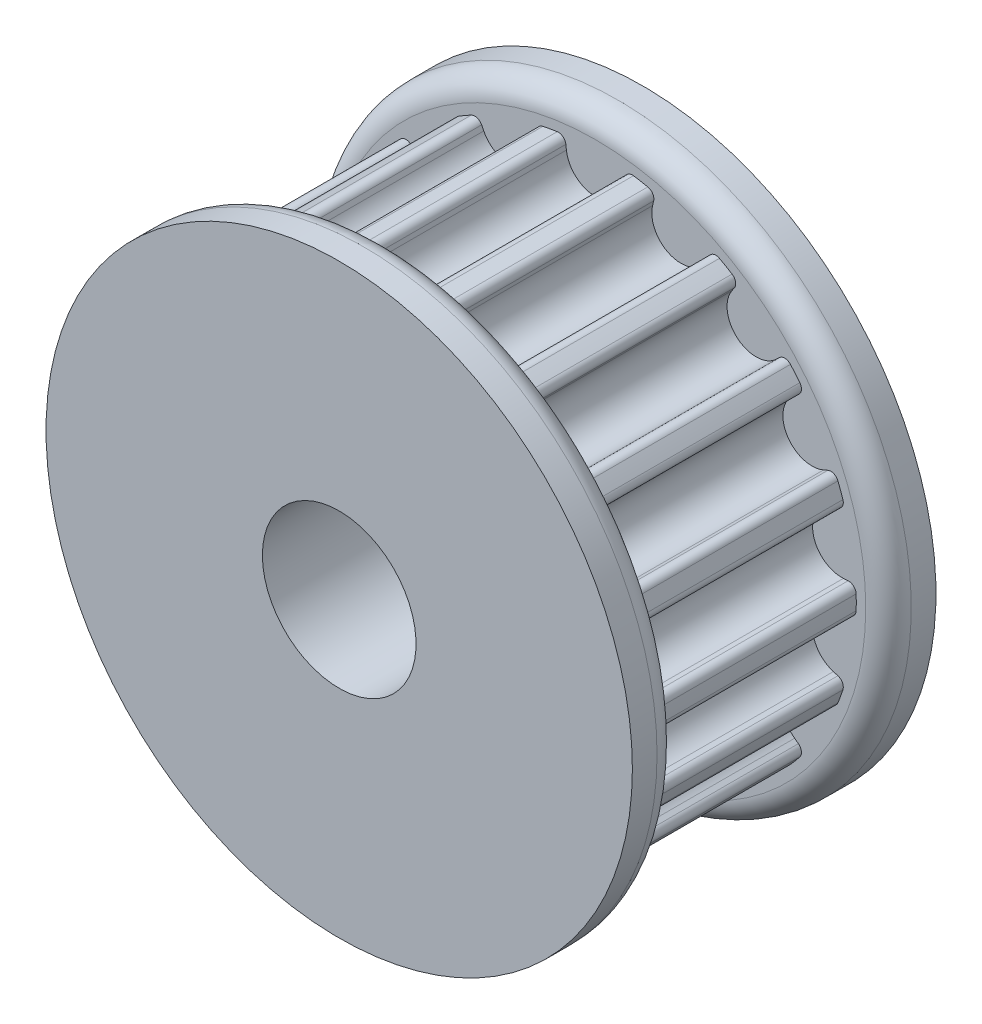
from build123d import *

# Parameters (mm, degrees)
SKETCH_3_R                       = 13.752444878
EXTRUDE_2_DEPTH                  = 5.5
CUT_EXTRUDE_2_DEPTH              = 21.211617458
FILLET_1_R                       = 0.4
PATTERN_CIRCULAR_1_COUNT         = 18
FILLET_1_OF_PATTERN_CIRCULAR_1_R = 0.4
SKETCH_12_R                      = 15.452444878
EXTRUDE_4_DEPTH                  = 2.5
EXTRUDE_START                    = 2.5
SKETCH_13_R                      = 15.452444878
EXTRUDE_5_DEPTH                  = 2.5
FILLET_2_R                       = 1.2
SKETCH_5_R                       = 9
EXTRUDE_3_DEPTH                  = 3
SKETCH_4_R                       = 4.05
CUT_EXTRUDE_3_DEPTH              = 29.957833231
SKETCH_8_W                       = 1.2
SKETCH_8_H                       = 15.452444878


with BuildPart() as part:
    # 스케치3 → 보스-돌출2 (new, symmetric)
    with BuildSketch(Plane.XY):
        Circle(SKETCH_3_R)
    extrude(amount=EXTRUDE_2_DEPTH, both=True)

    # 스케치3<3> → 컷-돌출2 (cut, symmetric)
    with BuildSketch(Plane.XY):
        with BuildLine():
            Line((-1.600765204, 13.658963756), (-1.524565963, 13.008773041))
            ThreePointArc((-1.524565963, 13.008773041), (0, 11.652444878), (1.524565963, 13.008773041))
            Line((1.524565963, 13.008773041), (1.600765204, 13.658963756))
            ThreePointArc((1.600765204, 13.658963756), (0, 13.752444878), (-1.600765204, 13.658963756))
        make_face()
    cut_extrude_2 = extrude(amount=CUT_EXTRUDE_2_DEPTH, both=True, mode=Mode.SUBTRACT)

    # 필렛1
    fillet_1_edges = [part.edges().sort_by_distance(p)[0] for p in [
        (1.600765204, 13.658963756, 0),
        (-1.600765204, 13.658963756, 0),
    ]]
    fillet(fillet_1_edges, radius=FILLET_1_R)

    # 원형 패턴1: 컷-돌출2 ×18 about axis
    pattern_circular_1_axis = Axis((0, 0, 5.5), (0, 0, -1))
    for i in range(1, PATTERN_CIRCULAR_1_COUNT):
        add(cut_extrude_2.rotate(pattern_circular_1_axis, i * 360 / PATTERN_CIRCULAR_1_COUNT), mode=Mode.SUBTRACT)

    # 필렛1 of 원형 패턴1
    fillet_1_of_pattern_circular_1_edges = [part.edges().sort_by_distance(p)[0] for p in [
        (6.175867991, 12.287733505, 0),
        (3.167413492, 13.382721394, 0),
        (10.006069953, 9.434421245, 0),
        (7.553555375, 11.492325323, 0),
        (12.629392204, 5.443178546, 0),
        (11.028627, 8.21578521, 0),
        (13.729423366, 0.795408182, 0),
        (13.173483445, 3.948300149, 0),
        (13.173483445, -3.948300149, 0),
        (13.729423366, -0.795408182, 0),
        (11.028627, -8.21578521, 0),
        (12.629392204, -5.443178546, 0),
        (7.553555375, -11.492325323, 0),
        (10.006069953, -9.434421245, 0),
        (3.167413492, -13.382721394, 0),
        (6.175867991, -12.287733505, 0),
        (-1.600765204, -13.658963756, 0),
        (1.600765204, -13.658963756, 0),
        (-6.175867991, -12.287733505, 0),
        (-3.167413492, -13.382721394, 0),
        (-10.006069953, -9.434421245, 0),
        (-7.553555375, -11.492325323, 0),
        (-12.629392204, -5.443178546, 0),
        (-11.028627, -8.21578521, 0),
        (-13.729423366, -0.795408182, 0),
        (-13.173483445, -3.948300149, 0),
        (-13.173483445, 3.948300149, 0),
        (-13.729423366, 0.795408182, 0),
        (-11.028627, 8.21578521, 0),
        (-12.629392204, 5.443178546, 0),
        (-7.553555375, 11.492325323, 0),
        (-10.006069953, 9.434421245, 0),
        (-3.167413492, 13.382721394, 0),
        (-6.175867991, 12.287733505, 0),
    ]]
    fillet(fillet_1_of_pattern_circular_1_edges, radius=FILLET_1_OF_PATTERN_CIRCULAR_1_R)

    # 스케치12 → 보스-돌출4 (add)
    with BuildSketch(Plane.XY.offset(5.5)):
        Circle(SKETCH_12_R)
    extrude(amount=EXTRUDE_4_DEPTH)

    # 스케치13 → 보스-돌출5 (add)
    with BuildSketch(Plane(origin=(0, 0, -5.5), x_dir=(-1, 0, 0), z_dir=(0, 0, -1)).offset(EXTRUDE_START)):
        Circle(SKETCH_13_R)
    extrude(amount=-EXTRUDE_5_DEPTH)

    # 필렛2
    fillet_2_edges = [part.edges().sort_by_distance(p)[0] for p in [
        (-15.452444878, 0, 5.5),
        (15.452444878, 0, -5.5),
    ]]
    fillet(fillet_2_edges, radius=FILLET_2_R)

    # 스케치5 → 보스-돌출3 (add)
    with BuildSketch(Plane(origin=(0, 0, -8), x_dir=(-1, 0, 0), z_dir=(0, 0, -1))):
        Circle(SKETCH_5_R)
    extrude(amount=EXTRUDE_3_DEPTH)

    # 스케치4 → 컷-돌출3 (cut, through all)
    with BuildSketch(Plane(origin=(0, 0, 8), x_dir=(-1, 0, 0), z_dir=(0, 0, -1))):
        Circle(SKETCH_4_R)
    extrude(amount=CUT_EXTRUDE_3_DEPTH, mode=Mode.SUBTRACT)

    # 스케치8 → M3x0.5 탭을 위한 탭 드릴1 (revolve, cut)
    with BuildSketch(Plane(origin=(0, 0, -9.5), x_dir=(0, 0, -1), z_dir=(1, 0, 0))):
        with Locations((0.6, 7.726222439)):
            Rectangle(SKETCH_8_W, SKETCH_8_H)
    revolve(axis=Axis((0, -6.35, -9.5), (0, 1, 0)), mode=Mode.SUBTRACT)


solid = part.part
